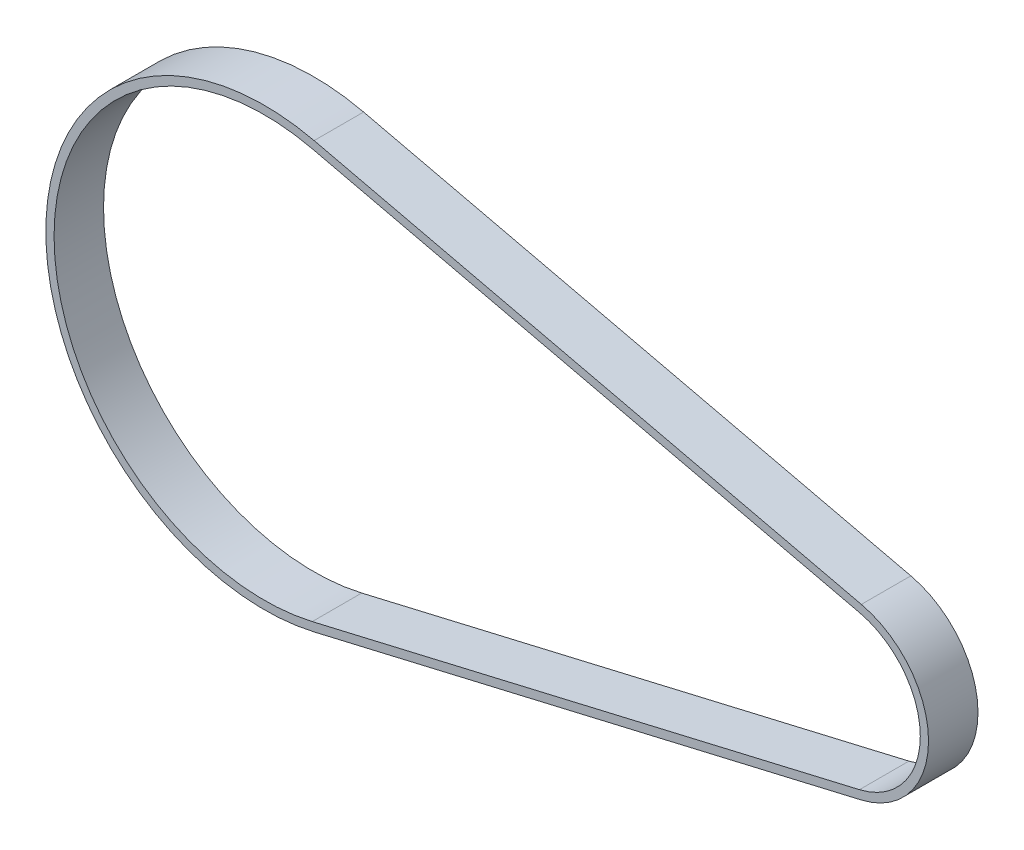
from build123d import *

# Parameters (mm, degrees)
BOSS_EXTRUDE1_DEPTH = 6


with BuildPart() as part:
    # Sketch1 → Boss-Extrude1 (new body)
    with BuildSketch(Plane.XY):
        with BuildLine():
            Line((6.038214286, 25.802906198), (72.403892857, 10.27247775))
            ThreePointArc((72.403892857, 10.27247775), (80.55, 0), (72.403892857, -10.27247775))
            Line((72.403892857, -10.27247775), (6.038214286, -25.802906198))
            ThreePointArc((6.038214286, -25.802906198), (-26.5, 0), (6.038214286, 25.802906198))
        make_face()
        with BuildLine():
            Line((5.810357143, 24.829211624), (72.176035714, 9.298783177))
            ThreePointArc((72.176035714, 9.298783177), (79.55, 0), (72.176035714, -9.298783177))
            Line((72.176035714, -9.298783177), (5.810357143, -24.829211624))
            ThreePointArc((5.810357143, -24.829211624), (-25.5, 0), (5.810357143, 24.829211624))
        make_face(mode=Mode.SUBTRACT)
    extrude(amount=BOSS_EXTRUDE1_DEPTH)


solid = part.part
